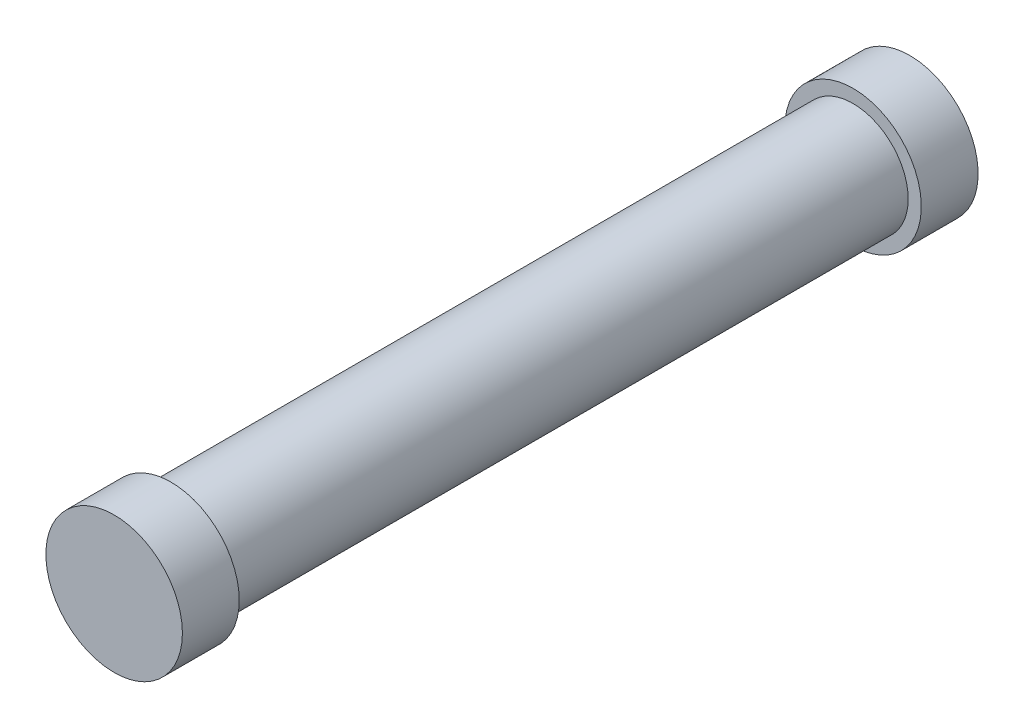
from build123d import *

# Parameters (mm, degrees)
SKETCH1_R           = 2.91
BOSS_EXTRUDE1_DEPTH = 36
SKETCH2_R           = 3.60324042
BOSS_EXTRUDE2_DEPTH = 3
BOSS_EXTRUDE3_START = 3
SKETCH3_R           = 3.60324042
BOSS_EXTRUDE3_DEPTH = 3


with BuildPart() as part:
    # Sketch1 → Boss-Extrude1 (new body)
    with BuildSketch(Plane.XY):
        Circle(SKETCH1_R)
    extrude(amount=BOSS_EXTRUDE1_DEPTH)

    # Sketch2 → Boss-Extrude2 (add)
    with BuildSketch(Plane.XY.offset(36)):
        Circle(SKETCH2_R)
    extrude(amount=BOSS_EXTRUDE2_DEPTH)

    # Sketch3 → Boss-Extrude3 (add)
    with BuildSketch(Plane(origin=(0, 0, 0), x_dir=(-1, 0, 0), z_dir=(0, 0, -1)).offset(BOSS_EXTRUDE3_START)):
        with Locations(Location((0, 0, 0), (0, 0, 180))):
            Circle(SKETCH3_R)
    extrude(amount=-BOSS_EXTRUDE3_DEPTH)


solid = part.part
